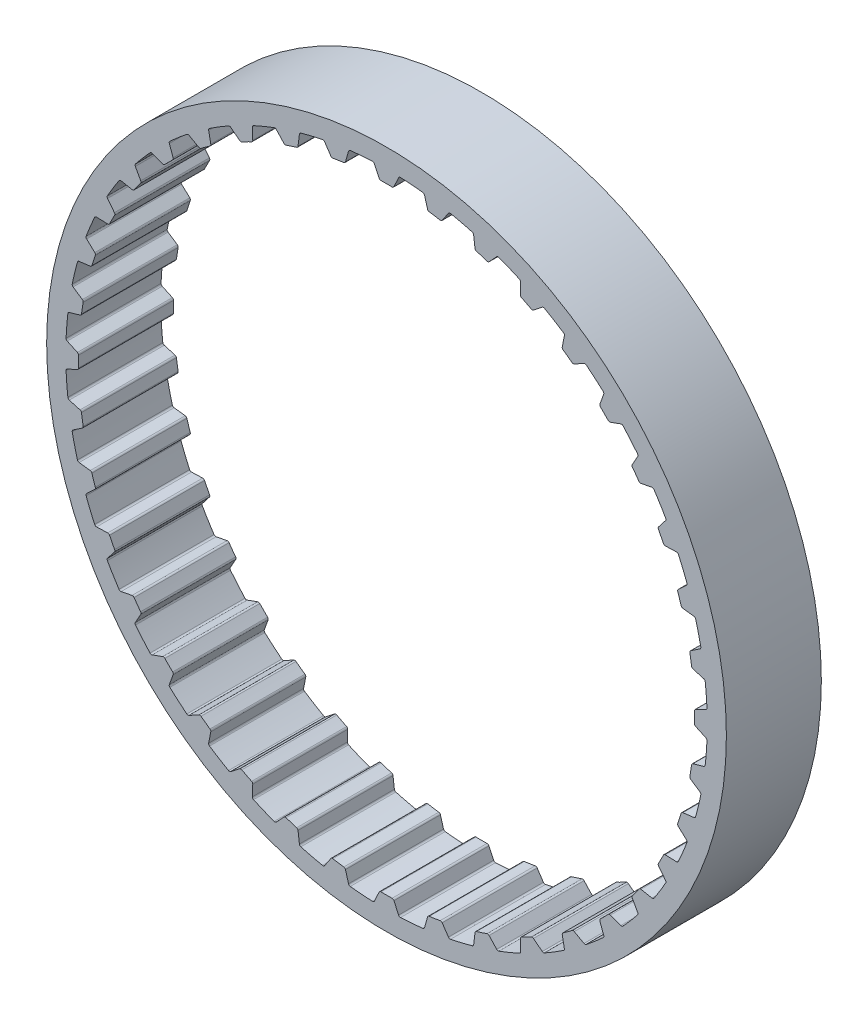
from build123d import *

# Parameters (mm, degrees)
SKETCH_1_R      = 34
EXTRUDE_1_DEPTH = 9.5


with BuildPart() as part:
    # ｽｹｯﾁ1 → ﾎﾞｽ - 押し出し1 (new body)
    with BuildSketch(Plane.XY):
        Circle(SKETCH_1_R)
        with BuildLine():
            Line((31.356107878, -6.194134392), (30.428929208, -5.568744482))
            ThreePointArc((30.428929208, -5.568744482), (30.35664476, -5.481031209), (30.343825882, -5.368096112))
            ThreePointArc((30.343825882, -5.368096112), (30.43561622, -4.820528012), (30.517526268, -4.271395028))
            ThreePointArc((30.517526268, -4.271395028), (30.564616621, -4.167948654), (30.66046809, -4.106865518))
            Line((30.66046809, -4.106865518), (31.735523516, -3.798598335))
            ThreePointArc((31.735523516, -3.798598335), (31.833048923, -3.735563251), (31.879112652, -3.628967005))
            ThreePointArc((31.879112652, -3.628967005), (31.986092651, -2.517360113), (32.054323385, -1.402703587))
            ThreePointArc((32.054323385, -1.402703587), (32.025502119, -1.290213733), (31.939038258, -1.212698358))
            Line((31.939038258, -1.212698358), (30.92544216, -0.740050735))
            ThreePointArc((30.92544216, -0.740050735), (30.840326305, -0.664725184), (30.809998274, -0.555185886))
            ThreePointArc((30.809998274, -0.555185886), (30.815, -2.9e-08), (30.809998275, 0.555185829))
            ThreePointArc((30.809998275, 0.555185829), (30.84032629, 0.66472516), (30.92544216, 0.740050735))
            Line((30.92544216, 0.740050735), (31.939038258, 1.212698358))
            ThreePointArc((31.939038258, 1.212698358), (32.025502105, 1.29021371), (32.054323387, 1.402703535))
            ThreePointArc((32.054323387, 1.402703535), (31.986092655, 2.51736006), (31.879112658, 3.628966953))
            ThreePointArc((31.879112658, 3.628966953), (31.83304894, 3.735563231), (31.735523516, 3.798598335))
            Line((31.735523516, 3.798598335), (30.66046809, 4.106865518))
            ThreePointArc((30.66046809, 4.106865518), (30.564616607, 4.16794867), (30.517526262, 4.271395069))
            ThreePointArc((30.517526262, 4.271395069), (30.435616212, 4.820528061), (30.343825872, 5.368096168))
            ThreePointArc((30.343825872, 5.368096168), (30.356644772, 5.481031235), (30.428929208, 5.568744482))
            Line((30.428929208, 5.568744482), (31.356107878, 6.194134392))
            ThreePointArc((31.356107878, 6.194134392), (31.429381139, 6.284221328), (31.440250298, 6.399834858))
            ThreePointArc((31.440250298, 6.399834858), (31.198488902, 7.490094474), (30.918932377, 8.571280282))
            ThreePointArc((30.918932377, 8.571280282), (30.856760448, 8.66935823), (30.750574861, 8.71636093))
            Line((30.750574861, 8.71636093), (29.640531539, 8.852657112))
            ThreePointArc((29.640531539, 8.852657112), (29.536304675, 8.897993722), (29.473611499, 8.992799908))
            ThreePointArc((29.473611499, 8.992799908), (29.306806558, 9.522358655), (29.13048777, 10.048826164))
            ThreePointArc((29.13048777, 10.048826164), (29.125481911, 10.162376131), (29.183155031, 10.260317259))
            Line((29.183155031, 10.260317259), (30.001086058, 11.023050281))
            ThreePointArc((30.001086058, 11.023050281), (30.059364508, 11.123490586), (30.052013884, 11.239381056))
            ThreePointArc((30.052013884, 11.239381056), (29.642674801, 12.278397927), (29.197425367, 13.302540245))
            ThreePointArc((29.197425367, 13.302540245), (29.120676106, 13.389684858), (29.008444997, 13.419497791))
            Line((29.008444997, 13.419497791), (27.89074673, 13.380466908))
            ThreePointArc((27.89074673, 13.380466908), (27.780710864, 13.408940675), (27.70395859, 13.492772266))
            ThreePointArc((27.70395859, 13.492772266), (27.456366056, 13.989717224), (27.199860381, 14.48212071))
            ThreePointArc((27.199860381, 14.48212071), (27.177153025, 14.593489599), (27.218794725, 14.699246973))
            Line((27.218794725, 14.699246973), (27.907337931, 15.580542088))
            ThreePointArc((27.907337931, 15.580542088), (27.949186551, 15.688862565), (27.923797162, 15.80217634))
            ThreePointArc((27.923797162, 15.80217634), (27.356959673, 16.764366449), (26.756980843, 17.706247518))
            ThreePointArc((26.756980843, 17.706247518), (26.667544072, 17.780313006), (26.552030945, 17.79220208))
            Line((26.552030945, 17.79220208), (25.454199173, 17.578805201))
            ThreePointArc((25.454199173, 17.578805201), (25.341063753, 17.589715007), (25.252142276, 17.660507791))
            ThreePointArc((25.252142276, 17.660507791), (24.929858698, 18.112602526), (24.599482158, 18.55881738))
            ThreePointArc((24.599482158, 18.55881738), (24.559632434, 18.66526292), (24.584217358, 18.776232443))
            Line((24.584217358, 18.776232443), (25.126418525, 19.754389241))
            ThreePointArc((25.126418525, 19.754389241), (25.150806863, 19.867922679), (25.10800388, 19.975869598))
            ThreePointArc((25.10800388, 19.975869598), (24.397625406, 20.837540631), (23.65769065, 21.673968213))
            ThreePointArc((23.65769065, 21.673968213), (23.557768599, 21.733130839), (23.441817769, 21.726803305))
            Line((23.441817769, 21.726803305), (22.390884755, 21.344294969))
            ThreePointArc((22.390884755, 21.344294969), (22.27743555, 21.337372179), (22.178534413, 21.393383003))
            ThreePointArc((22.178534413, 21.393383003), (21.789495482, 21.789495442), (21.393383044, 22.178534373))
            ThreePointArc((21.393383044, 22.178534373), (21.337372185, 22.277435522), (21.344294969, 22.390884755))
            Line((21.344294969, 22.390884755), (21.726803305, 23.441817769))
            ThreePointArc((21.726803305, 23.441817769), (21.733130839, 23.557768599), (21.673968213, 23.65769065))
            ThreePointArc((21.673968213, 23.65769065), (20.837540631, 24.397625406), (19.975869598, 25.10800388))
            ThreePointArc((19.975869598, 25.10800388), (19.867922679, 25.150806863), (19.754389241, 25.126418525))
            Line((19.754389241, 25.126418525), (18.776232443, 24.584217358))
            ThreePointArc((18.776232443, 24.584217358), (18.665262949, 24.559632432), (18.558817426, 24.599482124))
            ThreePointArc((18.558817426, 24.599482124), (18.112602572, 24.929858665), (17.660507838, 25.252142244))
            ThreePointArc((17.660507838, 25.252142244), (17.589715018, 25.341063726), (17.578805201, 25.454199173))
            Line((17.578805201, 25.454199173), (17.79220208, 26.552030945))
            ThreePointArc((17.79220208, 26.552030945), (17.780313006, 26.667544072), (17.706247518, 26.756980843))
            ThreePointArc((17.706247518, 26.756980843), (16.764366449, 27.356959673), (15.80217634, 27.923797162))
            ThreePointArc((15.80217634, 27.923797162), (15.688862565, 27.949186551), (15.580542088, 27.907337931))
            Line((15.580542088, 27.907337931), (14.699246973, 27.218794725))
            ThreePointArc((14.699246973, 27.218794725), (14.593489627, 27.177153027), (14.48212076, 27.199860354))
            ThreePointArc((14.48212076, 27.199860354), (13.989717275, 27.45636603), (13.492772318, 27.703958565))
            ThreePointArc((13.492772318, 27.703958565), (13.40894069, 27.78071084), (13.380466908, 27.89074673))
            Line((13.380466908, 27.89074673), (13.419497791, 29.008444997))
            ThreePointArc((13.419497791, 29.008444997), (13.389684858, 29.120676106), (13.302540245, 29.197425367))
            ThreePointArc((13.302540245, 29.197425367), (12.278397927, 29.642674801), (11.239381056, 30.052013884))
            ThreePointArc((11.239381056, 30.052013884), (11.123490586, 30.059364508), (11.023050281, 30.001086058))
            Line((11.023050281, 30.001086058), (10.260317259, 29.183155031))
            ThreePointArc((10.260317259, 29.183155031), (10.162376158, 29.125481918), (10.048826218, 29.130487751))
            ThreePointArc((10.048826218, 29.130487751), (9.522358709, 29.306806541), (8.992799963, 29.473611483))
            ThreePointArc((8.992799963, 29.473611483), (8.89799374, 29.536304653), (8.852657112, 29.640531539))
            Line((8.852657112, 29.640531539), (8.71636093, 30.750574861))
            ThreePointArc((8.71636093, 30.750574861), (8.66935823, 30.856760448), (8.571280282, 30.918932377))
            ThreePointArc((8.571280282, 30.918932377), (7.490094499, 31.198488896), (6.399834909, 31.440250287))
            ThreePointArc((6.399834909, 31.440250287), (6.284221352, 31.429381149), (6.194134392, 31.356107878))
            Line((6.194134392, 31.356107878), (5.568744482, 30.428929208))
            ThreePointArc((5.568744482, 30.428929208), (5.481031261, 30.356644783), (5.368096225, 30.343825862))
            ThreePointArc((5.368096225, 30.343825862), (4.820528068, 30.435616211), (4.271395028, 30.517526268))
            ThreePointArc((4.271395028, 30.517526268), (4.167948654, 30.564616621), (4.106865518, 30.66046809))
            Line((4.106865518, 30.66046809), (3.798598335, 31.735523516))
            ThreePointArc((3.798598335, 31.735523516), (3.735563231, 31.83304894), (3.628966953, 31.879112658))
            ThreePointArc((3.628966953, 31.879112658), (2.517360086, 31.986092653), (1.402703587, 32.054323385))
            ThreePointArc((1.402703587, 32.054323385), (1.290213733, 32.025502119), (1.212698358, 31.939038258))
            Line((1.212698358, 31.939038258), (0.740050735, 30.92544216))
            ThreePointArc((0.740050735, 30.92544216), (0.664725184, 30.840326305), (0.555185886, 30.809998274))
            ThreePointArc((0.555185886, 30.809998274), (2.9e-08, 30.815), (-0.555185829, 30.809998275))
            ThreePointArc((-0.555185829, 30.809998275), (-0.66472516, 30.84032629), (-0.740050735, 30.92544216))
            Line((-0.740050735, 30.92544216), (-1.212698358, 31.939038258))
            ThreePointArc((-1.212698358, 31.939038258), (-1.290213733, 32.025502119), (-1.402703587, 32.054323385))
            ThreePointArc((-1.402703587, 32.054323385), (-2.517360086, 31.986092653), (-3.628966953, 31.879112658))
            ThreePointArc((-3.628966953, 31.879112658), (-3.735563231, 31.83304894), (-3.798598335, 31.735523516))
            Line((-3.798598335, 31.735523516), (-4.106865518, 30.66046809))
            ThreePointArc((-4.106865518, 30.66046809), (-4.167948633, 30.56461664), (-4.271394971, 30.517526276))
            ThreePointArc((-4.271394971, 30.517526276), (-4.820528012, 30.43561622), (-5.368096168, 30.343825872))
            ThreePointArc((-5.368096168, 30.343825872), (-5.481031235, 30.356644772), (-5.568744482, 30.428929208))
            Line((-5.568744482, 30.428929208), (-6.194134392, 31.356107878))
            ThreePointArc((-6.194134392, 31.356107878), (-6.284221352, 31.429381149), (-6.399834909, 31.440250287))
            ThreePointArc((-6.399834909, 31.440250287), (-7.490094499, 31.198488896), (-8.571280282, 30.918932377))
            ThreePointArc((-8.571280282, 30.918932377), (-8.66935823, 30.856760448), (-8.71636093, 30.750574861))
            Line((-8.71636093, 30.750574861), (-8.852657112, 29.640531539))
            ThreePointArc((-8.852657112, 29.640531539), (-8.897993722, 29.536304675), (-8.992799908, 29.473611499))
            ThreePointArc((-8.992799908, 29.473611499), (-9.522358655, 29.306806558), (-10.048826164, 29.13048777))
            ThreePointArc((-10.048826164, 29.13048777), (-10.162376131, 29.125481911), (-10.260317259, 29.183155031))
            Line((-10.260317259, 29.183155031), (-11.023050281, 30.001086058))
            ThreePointArc((-11.023050281, 30.001086058), (-11.123490586, 30.059364508), (-11.239381056, 30.052013884))
            ThreePointArc((-11.239381056, 30.052013884), (-12.278397927, 29.642674801), (-13.302540245, 29.197425367))
            ThreePointArc((-13.302540245, 29.197425367), (-13.389684858, 29.120676106), (-13.419497791, 29.008444997))
            Line((-13.419497791, 29.008444997), (-13.380466908, 27.89074673))
            ThreePointArc((-13.380466908, 27.89074673), (-13.408940675, 27.780710864), (-13.492772266, 27.70395859))
            ThreePointArc((-13.492772266, 27.70395859), (-13.989717224, 27.456366056), (-14.48212071, 27.199860381))
            ThreePointArc((-14.48212071, 27.199860381), (-14.593489599, 27.177153025), (-14.699246973, 27.218794725))
            Line((-14.699246973, 27.218794725), (-15.580542088, 27.907337931))
            ThreePointArc((-15.580542088, 27.907337931), (-15.688862565, 27.949186551), (-15.80217634, 27.923797162))
            ThreePointArc((-15.80217634, 27.923797162), (-16.764366449, 27.356959673), (-17.706247518, 26.756980843))
            ThreePointArc((-17.706247518, 26.756980843), (-17.780313006, 26.667544072), (-17.79220208, 26.552030945))
            Line((-17.79220208, 26.552030945), (-17.578805201, 25.454199173))
            ThreePointArc((-17.578805201, 25.454199173), (-17.589715007, 25.341063753), (-17.660507791, 25.252142276))
            ThreePointArc((-17.660507791, 25.252142276), (-18.112602526, 24.929858698), (-18.55881738, 24.599482158))
            ThreePointArc((-18.55881738, 24.599482158), (-18.66526292, 24.559632434), (-18.776232443, 24.584217358))
            Line((-18.776232443, 24.584217358), (-19.754389241, 25.126418525))
            ThreePointArc((-19.754389241, 25.126418525), (-19.867922679, 25.150806863), (-19.975869598, 25.10800388))
            ThreePointArc((-19.975869598, 25.10800388), (-20.837540631, 24.397625406), (-21.673968213, 23.65769065))
            ThreePointArc((-21.673968213, 23.65769065), (-21.733130839, 23.557768599), (-21.726803305, 23.441817769))
            Line((-21.726803305, 23.441817769), (-21.344294969, 22.390884755))
            ThreePointArc((-21.344294969, 22.390884755), (-21.337372179, 22.27743555), (-21.393383003, 22.178534413))
            ThreePointArc((-21.393383003, 22.178534413), (-21.789495442, 21.789495482), (-22.178534373, 21.393383044))
            ThreePointArc((-22.178534373, 21.393383044), (-22.277435522, 21.337372185), (-22.390884755, 21.344294969))
            Line((-22.390884755, 21.344294969), (-23.441817769, 21.726803305))
            ThreePointArc((-23.441817769, 21.726803305), (-23.557768599, 21.733130839), (-23.65769065, 21.673968213))
            ThreePointArc((-23.65769065, 21.673968213), (-24.397625406, 20.837540631), (-25.10800388, 19.975869598))
            ThreePointArc((-25.10800388, 19.975869598), (-25.150806863, 19.867922679), (-25.126418525, 19.754389241))
            Line((-25.126418525, 19.754389241), (-24.584217358, 18.776232443))
            ThreePointArc((-24.584217358, 18.776232443), (-24.559632432, 18.665262949), (-24.599482124, 18.558817426))
            ThreePointArc((-24.599482124, 18.558817426), (-24.929858665, 18.112602572), (-25.252142244, 17.660507838))
            ThreePointArc((-25.252142244, 17.660507838), (-25.341063726, 17.589715018), (-25.454199173, 17.578805201))
            Line((-25.454199173, 17.578805201), (-26.552030945, 17.79220208))
            ThreePointArc((-26.552030945, 17.79220208), (-26.667544072, 17.780313006), (-26.756980843, 17.706247518))
            ThreePointArc((-26.756980843, 17.706247518), (-27.356959673, 16.764366449), (-27.923797162, 15.80217634))
            ThreePointArc((-27.923797162, 15.80217634), (-27.949186551, 15.688862565), (-27.907337931, 15.580542088))
            Line((-27.907337931, 15.580542088), (-27.218794725, 14.699246973))
            ThreePointArc((-27.218794725, 14.699246973), (-27.177153027, 14.593489627), (-27.199860354, 14.48212076))
            ThreePointArc((-27.199860354, 14.48212076), (-27.45636603, 13.989717275), (-27.703958565, 13.492772318))
            ThreePointArc((-27.703958565, 13.492772318), (-27.78071084, 13.40894069), (-27.89074673, 13.380466908))
            Line((-27.89074673, 13.380466908), (-29.008444997, 13.419497791))
            ThreePointArc((-29.008444997, 13.419497791), (-29.120676106, 13.389684858), (-29.197425367, 13.302540245))
            ThreePointArc((-29.197425367, 13.302540245), (-29.642674801, 12.278397927), (-30.052013884, 11.239381056))
            ThreePointArc((-30.052013884, 11.239381056), (-30.059364508, 11.123490586), (-30.001086058, 11.023050281))
            Line((-30.001086058, 11.023050281), (-29.183155031, 10.260317259))
            ThreePointArc((-29.183155031, 10.260317259), (-29.125481918, 10.162376158), (-29.130487751, 10.048826218))
            ThreePointArc((-29.130487751, 10.048826218), (-29.306806541, 9.522358709), (-29.473611483, 8.992799963))
            ThreePointArc((-29.473611483, 8.992799963), (-29.536304653, 8.89799374), (-29.640531539, 8.852657112))
            Line((-29.640531539, 8.852657112), (-30.750574861, 8.71636093))
            ThreePointArc((-30.750574861, 8.71636093), (-30.856760448, 8.66935823), (-30.918932377, 8.571280282))
            ThreePointArc((-30.918932377, 8.571280282), (-31.198488896, 7.490094499), (-31.440250287, 6.399834909))
            ThreePointArc((-31.440250287, 6.399834909), (-31.429381149, 6.284221352), (-31.356107878, 6.194134392))
            Line((-31.356107878, 6.194134392), (-30.428929208, 5.568744482))
            ThreePointArc((-30.428929208, 5.568744482), (-30.356644783, 5.481031261), (-30.343825862, 5.368096225))
            ThreePointArc((-30.343825862, 5.368096225), (-30.435616211, 4.820528068), (-30.517526268, 4.271395028))
            ThreePointArc((-30.517526268, 4.271395028), (-30.564616621, 4.167948654), (-30.66046809, 4.106865518))
            Line((-30.66046809, 4.106865518), (-31.735523516, 3.798598335))
            ThreePointArc((-31.735523516, 3.798598335), (-31.83304894, 3.735563231), (-31.879112658, 3.628966953))
            ThreePointArc((-31.879112658, 3.628966953), (-31.986092653, 2.517360086), (-32.054323385, 1.402703587))
            ThreePointArc((-32.054323385, 1.402703587), (-32.025502119, 1.290213733), (-31.939038258, 1.212698358))
            Line((-31.939038258, 1.212698358), (-30.92544216, 0.740050735))
            ThreePointArc((-30.92544216, 0.740050735), (-30.840326305, 0.664725184), (-30.809998274, 0.555185886))
            ThreePointArc((-30.809998274, 0.555185886), (-30.815, 2.9e-08), (-30.809998275, -0.555185829))
            ThreePointArc((-30.809998275, -0.555185829), (-30.84032629, -0.66472516), (-30.92544216, -0.740050735))
            Line((-30.92544216, -0.740050735), (-31.939038258, -1.212698358))
            ThreePointArc((-31.939038258, -1.212698358), (-32.025502119, -1.290213733), (-32.054323385, -1.402703587))
            ThreePointArc((-32.054323385, -1.402703587), (-31.986092653, -2.517360086), (-31.879112658, -3.628966953))
            ThreePointArc((-31.879112658, -3.628966953), (-31.83304894, -3.735563231), (-31.735523516, -3.798598335))
            Line((-31.735523516, -3.798598335), (-30.66046809, -4.106865518))
            ThreePointArc((-30.66046809, -4.106865518), (-30.56461664, -4.167948633), (-30.517526276, -4.271394971))
            ThreePointArc((-30.517526276, -4.271394971), (-30.43561622, -4.820528012), (-30.343825872, -5.368096168))
            ThreePointArc((-30.343825872, -5.368096168), (-30.356644772, -5.481031235), (-30.428929208, -5.568744482))
            Line((-30.428929208, -5.568744482), (-31.356107878, -6.194134392))
            ThreePointArc((-31.356107878, -6.194134392), (-31.429381149, -6.284221352), (-31.440250287, -6.399834909))
            ThreePointArc((-31.440250287, -6.399834909), (-31.198488896, -7.490094499), (-30.918932377, -8.571280282))
            ThreePointArc((-30.918932377, -8.571280282), (-30.856760448, -8.66935823), (-30.750574861, -8.71636093))
            Line((-30.750574861, -8.71636093), (-29.640531539, -8.852657112))
            ThreePointArc((-29.640531539, -8.852657112), (-29.536304675, -8.897993722), (-29.473611499, -8.992799908))
            ThreePointArc((-29.473611499, -8.992799908), (-29.306806558, -9.522358655), (-29.13048777, -10.048826164))
            ThreePointArc((-29.13048777, -10.048826164), (-29.125481911, -10.162376131), (-29.183155031, -10.260317259))
            Line((-29.183155031, -10.260317259), (-30.001086058, -11.023050281))
            ThreePointArc((-30.001086058, -11.023050281), (-30.059364508, -11.123490586), (-30.052013884, -11.239381056))
            ThreePointArc((-30.052013884, -11.239381056), (-29.642674801, -12.278397927), (-29.197425367, -13.302540245))
            ThreePointArc((-29.197425367, -13.302540245), (-29.120676106, -13.389684858), (-29.008444997, -13.419497791))
            Line((-29.008444997, -13.419497791), (-27.89074673, -13.380466908))
            ThreePointArc((-27.89074673, -13.380466908), (-27.780710864, -13.408940675), (-27.70395859, -13.492772266))
            ThreePointArc((-27.70395859, -13.492772266), (-27.456366056, -13.989717224), (-27.199860381, -14.48212071))
            ThreePointArc((-27.199860381, -14.48212071), (-27.177153025, -14.593489599), (-27.218794725, -14.699246973))
            Line((-27.218794725, -14.699246973), (-27.907337931, -15.580542088))
            ThreePointArc((-27.907337931, -15.580542088), (-27.949186551, -15.688862565), (-27.923797162, -15.80217634))
            ThreePointArc((-27.923797162, -15.80217634), (-27.356959673, -16.764366449), (-26.756980843, -17.706247518))
            ThreePointArc((-26.756980843, -17.706247518), (-26.667544072, -17.780313006), (-26.552030945, -17.79220208))
            Line((-26.552030945, -17.79220208), (-25.454199173, -17.578805201))
            ThreePointArc((-25.454199173, -17.578805201), (-25.341063753, -17.589715007), (-25.252142276, -17.660507791))
            ThreePointArc((-25.252142276, -17.660507791), (-24.929858698, -18.112602526), (-24.599482158, -18.55881738))
            ThreePointArc((-24.599482158, -18.55881738), (-24.559632434, -18.66526292), (-24.584217358, -18.776232443))
            Line((-24.584217358, -18.776232443), (-25.126418525, -19.754389241))
            ThreePointArc((-25.126418525, -19.754389241), (-25.150806863, -19.867922679), (-25.10800388, -19.975869598))
            ThreePointArc((-25.10800388, -19.975869598), (-24.397625406, -20.837540631), (-23.65769065, -21.673968213))
            ThreePointArc((-23.65769065, -21.673968213), (-23.557768599, -21.733130839), (-23.441817769, -21.726803305))
            Line((-23.441817769, -21.726803305), (-22.390884755, -21.344294969))
            ThreePointArc((-22.390884755, -21.344294969), (-22.27743555, -21.337372179), (-22.178534413, -21.393383003))
            ThreePointArc((-22.178534413, -21.393383003), (-21.789495482, -21.789495442), (-21.393383044, -22.178534373))
            ThreePointArc((-21.393383044, -22.178534373), (-21.337372185, -22.277435522), (-21.344294969, -22.390884755))
            Line((-21.344294969, -22.390884755), (-21.726803305, -23.441817769))
            ThreePointArc((-21.726803305, -23.441817769), (-21.733130839, -23.557768599), (-21.673968213, -23.65769065))
            ThreePointArc((-21.673968213, -23.65769065), (-20.837540631, -24.397625406), (-19.975869598, -25.10800388))
            ThreePointArc((-19.975869598, -25.10800388), (-19.867922679, -25.150806863), (-19.754389241, -25.126418525))
            Line((-19.754389241, -25.126418525), (-18.776232443, -24.584217358))
            ThreePointArc((-18.776232443, -24.584217358), (-18.665262949, -24.559632432), (-18.558817426, -24.599482124))
            ThreePointArc((-18.558817426, -24.599482124), (-18.112602572, -24.929858665), (-17.660507838, -25.252142244))
            ThreePointArc((-17.660507838, -25.252142244), (-17.589715018, -25.341063726), (-17.578805201, -25.454199173))
            Line((-17.578805201, -25.454199173), (-17.79220208, -26.552030945))
            ThreePointArc((-17.79220208, -26.552030945), (-17.780313006, -26.667544072), (-17.706247518, -26.756980843))
            ThreePointArc((-17.706247518, -26.756980843), (-16.764366449, -27.356959673), (-15.80217634, -27.923797162))
            ThreePointArc((-15.80217634, -27.923797162), (-15.688862565, -27.949186551), (-15.580542088, -27.907337931))
            Line((-15.580542088, -27.907337931), (-14.699246973, -27.218794725))
            ThreePointArc((-14.699246973, -27.218794725), (-14.593489627, -27.177153027), (-14.48212076, -27.199860354))
            ThreePointArc((-14.48212076, -27.199860354), (-13.989717275, -27.45636603), (-13.492772318, -27.703958565))
            ThreePointArc((-13.492772318, -27.703958565), (-13.40894069, -27.78071084), (-13.380466908, -27.89074673))
            Line((-13.380466908, -27.89074673), (-13.419497791, -29.008444997))
            ThreePointArc((-13.419497791, -29.008444997), (-13.389684858, -29.120676106), (-13.302540245, -29.197425367))
            ThreePointArc((-13.302540245, -29.197425367), (-12.278397927, -29.642674801), (-11.239381056, -30.052013884))
            ThreePointArc((-11.239381056, -30.052013884), (-11.123490586, -30.059364508), (-11.023050281, -30.001086058))
            Line((-11.023050281, -30.001086058), (-10.260317259, -29.183155031))
            ThreePointArc((-10.260317259, -29.183155031), (-10.162376158, -29.125481918), (-10.048826218, -29.130487751))
            ThreePointArc((-10.048826218, -29.130487751), (-9.522358709, -29.306806541), (-8.992799963, -29.473611483))
            ThreePointArc((-8.992799963, -29.473611483), (-8.89799374, -29.536304653), (-8.852657112, -29.640531539))
            Line((-8.852657112, -29.640531539), (-8.71636093, -30.750574861))
            ThreePointArc((-8.71636093, -30.750574861), (-8.66935823, -30.856760448), (-8.571280282, -30.918932377))
            ThreePointArc((-8.571280282, -30.918932377), (-7.490094499, -31.198488896), (-6.399834909, -31.440250287))
            ThreePointArc((-6.399834909, -31.440250287), (-6.284221352, -31.429381149), (-6.194134392, -31.356107878))
            Line((-6.194134392, -31.356107878), (-5.568744482, -30.428929208))
            ThreePointArc((-5.568744482, -30.428929208), (-5.481031261, -30.356644783), (-5.368096225, -30.343825862))
            ThreePointArc((-5.368096225, -30.343825862), (-4.820528068, -30.435616211), (-4.271395028, -30.517526268))
            ThreePointArc((-4.271395028, -30.517526268), (-4.167948654, -30.564616621), (-4.106865518, -30.66046809))
            Line((-4.106865518, -30.66046809), (-3.798598335, -31.735523516))
            ThreePointArc((-3.798598335, -31.735523516), (-3.735563231, -31.83304894), (-3.628966953, -31.879112658))
            ThreePointArc((-3.628966953, -31.879112658), (-2.517360086, -31.986092653), (-1.402703587, -32.054323385))
            ThreePointArc((-1.402703587, -32.054323385), (-1.290213733, -32.025502119), (-1.212698358, -31.939038258))
            Line((-1.212698358, -31.939038258), (-0.740050735, -30.92544216))
            ThreePointArc((-0.740050735, -30.92544216), (-0.664725184, -30.840326305), (-0.555185886, -30.809998274))
            ThreePointArc((-0.555185886, -30.809998274), (-2.9e-08, -30.815), (0.555185829, -30.809998275))
            ThreePointArc((0.555185829, -30.809998275), (0.66472516, -30.84032629), (0.740050735, -30.92544216))
            Line((0.740050735, -30.92544216), (1.212698358, -31.939038258))
            ThreePointArc((1.212698358, -31.939038258), (1.290213733, -32.025502119), (1.402703587, -32.054323385))
            ThreePointArc((1.402703587, -32.054323385), (2.517360086, -31.986092653), (3.628966953, -31.879112658))
            ThreePointArc((3.628966953, -31.879112658), (3.735563231, -31.83304894), (3.798598335, -31.735523516))
            Line((3.798598335, -31.735523516), (4.106865518, -30.66046809))
            ThreePointArc((4.106865518, -30.66046809), (4.167948633, -30.56461664), (4.271394971, -30.517526276))
            ThreePointArc((4.271394971, -30.517526276), (4.820528012, -30.43561622), (5.368096168, -30.343825872))
            ThreePointArc((5.368096168, -30.343825872), (5.481031235, -30.356644772), (5.568744482, -30.428929208))
            Line((5.568744482, -30.428929208), (6.194134392, -31.356107878))
            ThreePointArc((6.194134392, -31.356107878), (6.284221352, -31.429381149), (6.399834909, -31.440250287))
            ThreePointArc((6.399834909, -31.440250287), (7.490094499, -31.198488896), (8.571280282, -30.918932377))
            ThreePointArc((8.571280282, -30.918932377), (8.66935823, -30.856760448), (8.71636093, -30.750574861))
            Line((8.71636093, -30.750574861), (8.852657112, -29.640531539))
            ThreePointArc((8.852657112, -29.640531539), (8.897993722, -29.536304675), (8.992799908, -29.473611499))
            ThreePointArc((8.992799908, -29.473611499), (9.522358655, -29.306806558), (10.048826164, -29.13048777))
            ThreePointArc((10.048826164, -29.13048777), (10.162376131, -29.125481911), (10.260317259, -29.183155031))
            Line((10.260317259, -29.183155031), (11.023050281, -30.001086058))
            ThreePointArc((11.023050281, -30.001086058), (11.123490586, -30.059364508), (11.239381056, -30.052013884))
            ThreePointArc((11.239381056, -30.052013884), (12.278397927, -29.642674801), (13.302540245, -29.197425367))
            ThreePointArc((13.302540245, -29.197425367), (13.389684858, -29.120676106), (13.419497791, -29.008444997))
            Line((13.419497791, -29.008444997), (13.380466908, -27.89074673))
            ThreePointArc((13.380466908, -27.89074673), (13.408940675, -27.780710864), (13.492772266, -27.70395859))
            ThreePointArc((13.492772266, -27.70395859), (13.989717224, -27.456366056), (14.48212071, -27.199860381))
            ThreePointArc((14.48212071, -27.199860381), (14.593489599, -27.177153025), (14.699246973, -27.218794725))
            Line((14.699246973, -27.218794725), (15.580542088, -27.907337931))
            ThreePointArc((15.580542088, -27.907337931), (15.688862565, -27.949186551), (15.80217634, -27.923797162))
            ThreePointArc((15.80217634, -27.923797162), (16.764366449, -27.356959673), (17.706247518, -26.756980843))
            ThreePointArc((17.706247518, -26.756980843), (17.780313006, -26.667544072), (17.79220208, -26.552030945))
            Line((17.79220208, -26.552030945), (17.578805201, -25.454199173))
            ThreePointArc((17.578805201, -25.454199173), (17.589715007, -25.341063753), (17.660507791, -25.252142276))
            ThreePointArc((17.660507791, -25.252142276), (18.112602526, -24.929858698), (18.55881738, -24.599482158))
            ThreePointArc((18.55881738, -24.599482158), (18.66526292, -24.559632434), (18.776232443, -24.584217358))
            Line((18.776232443, -24.584217358), (19.754389241, -25.126418525))
            ThreePointArc((19.754389241, -25.126418525), (19.867922679, -25.150806863), (19.975869598, -25.10800388))
            ThreePointArc((19.975869598, -25.10800388), (20.837540631, -24.397625406), (21.673968213, -23.65769065))
            ThreePointArc((21.673968213, -23.65769065), (21.733130839, -23.557768599), (21.726803305, -23.441817769))
            Line((21.726803305, -23.441817769), (21.344294969, -22.390884755))
            ThreePointArc((21.344294969, -22.390884755), (21.337372179, -22.27743555), (21.393383003, -22.178534413))
            ThreePointArc((21.393383003, -22.178534413), (21.789495442, -21.789495482), (22.178534373, -21.393383044))
            ThreePointArc((22.178534373, -21.393383044), (22.277435522, -21.337372185), (22.390884755, -21.344294969))
            Line((22.390884755, -21.344294969), (23.441817769, -21.726803305))
            ThreePointArc((23.441817769, -21.726803305), (23.557768599, -21.733130839), (23.65769065, -21.673968213))
            ThreePointArc((23.65769065, -21.673968213), (24.397625406, -20.837540631), (25.10800388, -19.975869598))
            ThreePointArc((25.10800388, -19.975869598), (25.150806863, -19.867922679), (25.126418525, -19.754389241))
            Line((25.126418525, -19.754389241), (24.584217358, -18.776232443))
            ThreePointArc((24.584217358, -18.776232443), (24.559632432, -18.665262949), (24.599482124, -18.558817426))
            ThreePointArc((24.599482124, -18.558817426), (24.929858665, -18.112602572), (25.252142244, -17.660507838))
            ThreePointArc((25.252142244, -17.660507838), (25.341063726, -17.589715018), (25.454199173, -17.578805201))
            Line((25.454199173, -17.578805201), (26.552030945, -17.79220208))
            ThreePointArc((26.552030945, -17.79220208), (26.667544072, -17.780313006), (26.756980843, -17.706247518))
            ThreePointArc((26.756980843, -17.706247518), (27.356959673, -16.764366449), (27.923797162, -15.80217634))
            ThreePointArc((27.923797162, -15.80217634), (27.949186551, -15.688862565), (27.907337931, -15.580542088))
            Line((27.907337931, -15.580542088), (27.218794725, -14.699246973))
            ThreePointArc((27.218794725, -14.699246973), (27.177153027, -14.593489627), (27.199860354, -14.48212076))
            ThreePointArc((27.199860354, -14.48212076), (27.45636603, -13.989717275), (27.703958565, -13.492772318))
            ThreePointArc((27.703958565, -13.492772318), (27.78071084, -13.40894069), (27.89074673, -13.380466908))
            Line((27.89074673, -13.380466908), (29.008444997, -13.419497791))
            ThreePointArc((29.008444997, -13.419497791), (29.120676106, -13.389684858), (29.197425367, -13.302540245))
            ThreePointArc((29.197425367, -13.302540245), (29.642674801, -12.278397927), (30.052013884, -11.239381056))
            ThreePointArc((30.052013884, -11.239381056), (30.059364508, -11.123490586), (30.001086058, -11.023050281))
            Line((30.001086058, -11.023050281), (29.183155031, -10.260317259))
            ThreePointArc((29.183155031, -10.260317259), (29.125481918, -10.162376158), (29.130487751, -10.048826218))
            ThreePointArc((29.130487751, -10.048826218), (29.306806541, -9.522358709), (29.473611483, -8.992799963))
            ThreePointArc((29.473611483, -8.992799963), (29.536304653, -8.89799374), (29.640531539, -8.852657112))
            Line((29.640531539, -8.852657112), (30.750574861, -8.71636093))
            ThreePointArc((30.750574861, -8.71636093), (30.856760448, -8.66935823), (30.918932377, -8.571280282))
            ThreePointArc((30.918932377, -8.571280282), (31.198488896, -7.490094499), (31.440250287, -6.399834909))
            ThreePointArc((31.440250287, -6.399834909), (31.429381149, -6.284221352), (31.356107878, -6.194134392))
        make_face(mode=Mode.SUBTRACT)
    extrude(amount=EXTRUDE_1_DEPTH)


solid = part.part
